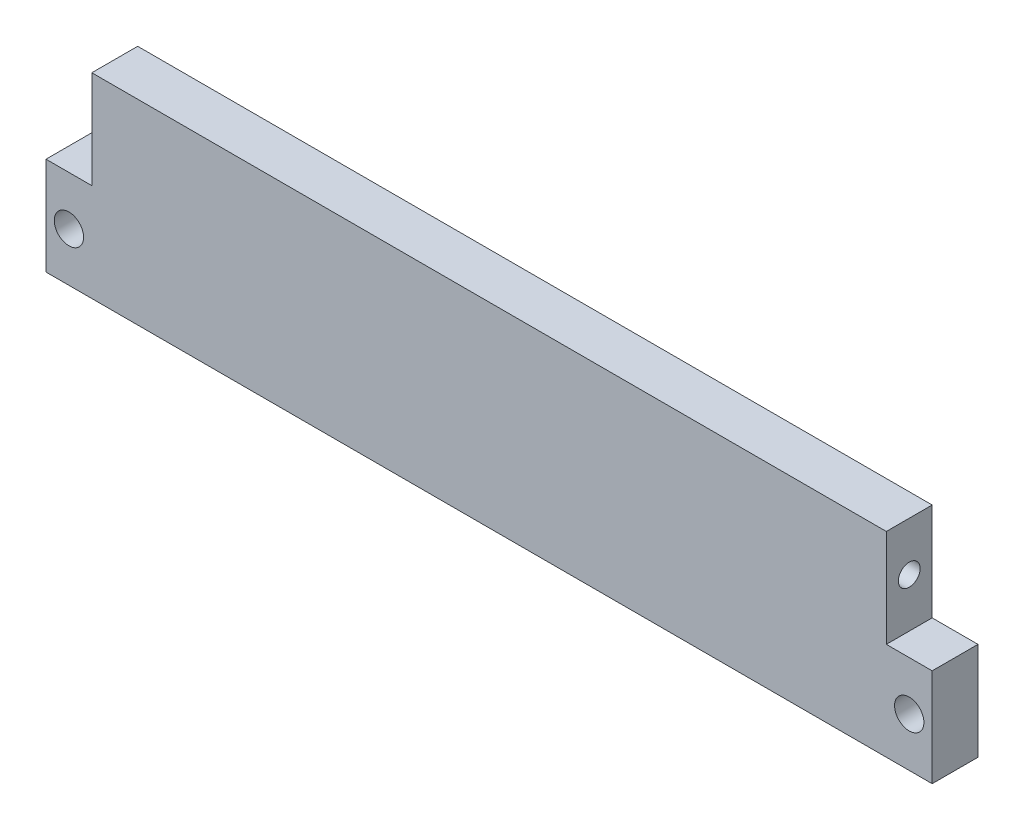
from build123d import *

# Parameters (mm, degrees)
SKETCH1_R           = 1.524
BOSS_EXTRUDE1_DEPTH = 4.7625
SKETCH2_R           = 1.1303
CUT_EXTRUDE1_DEPTH  = 6.35
CUT_EXTRUDE2_START  = -6.35
SKETCH3_R           = 1.1303
CUT_EXTRUDE2_DEPTH  = 6.35


with BuildPart() as part:
    # Sketch1 → Boss-Extrude1 (new body)
    with BuildSketch(Plane.XY):
        Polygon((-46.0375, 0), (46.0375, 0), (46.0375, 10.16), (41.275, 10.16), (41.275, 20.32), (-41.275, 20.32), (-41.275, 10.16), (-46.0375, 10.16), align=None)
        with Locations(Location((-43.65625, 5.08, 0), (0, 0, 180))):
            Circle(SKETCH1_R, mode=Mode.SUBTRACT)
        with Locations(Location((43.65625, 5.08, 0), (0, 0, 180))):
            Circle(SKETCH1_R, mode=Mode.SUBTRACT)
    extrude(amount=BOSS_EXTRUDE1_DEPTH)

    # Sketch2 → Cut-Extrude1 (cut)
    with BuildSketch(Plane(origin=(41.275, 0, 0), x_dir=(0, 0, -1), z_dir=(1, 0, 0))):
        with Locations(Location((-2.38125, 15.24, 0), (0, 0, 90))):
            Circle(SKETCH2_R)
    extrude(amount=-CUT_EXTRUDE1_DEPTH, mode=Mode.SUBTRACT)

    # Sketch3 → Cut-Extrude2 (cut)
    with BuildSketch(Plane.ZY.offset(41.275).offset(CUT_EXTRUDE2_START)):
        with Locations(Location((2.38125, 15.24, 0), (0, 0, 90))):
            Circle(SKETCH3_R)
    extrude(amount=CUT_EXTRUDE2_DEPTH, mode=Mode.SUBTRACT)


solid = part.part
